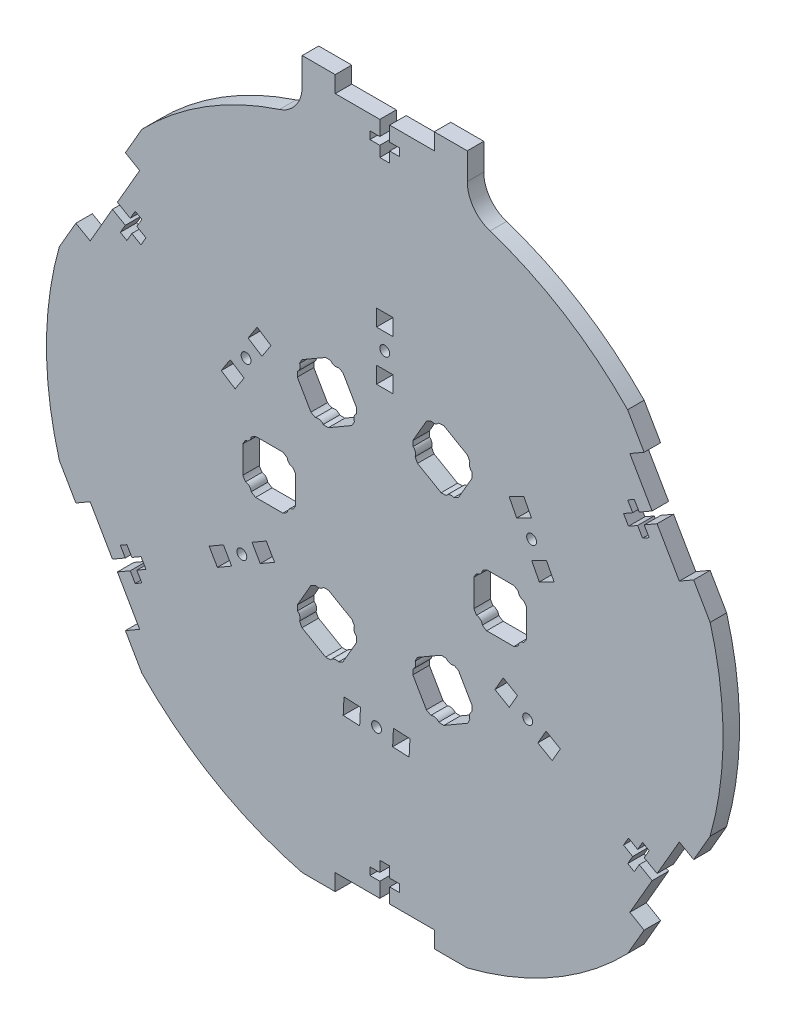
from build123d import *

# Parameters (mm, degrees)
ESQUISSE1_R        = 1.5
ESQUISSE1_W        = 5
ESQUISSE1_H        = 5
BOSS_EXTRU_1_DEPTH = 5
CONG_1_R           = 10


with BuildPart() as part:
    # Esquisse1 → Boss.-Extru.1 (new body)
    with BuildSketch(Plane.XY):
        with BuildLine():
            Line((-25, 99.40447676), (-25, 115))
            Line((-25, 115), (-15, 115))
            Line((-15, 115), (-15, 110))
            Line((-15, 110), (-1.5, 110))
            Line((-1.5, 110), (-1.5, 105.5))
            Line((-1.5, 105.5), (-4.5, 105.5))
            Line((-4.5, 105.5), (-4.5, 103.2))
            Line((-4.5, 103.2), (-1.5, 103.2))
            Line((-1.5, 103.2), (-1.5, 100))
            Line((-1.5, 100), (1.5, 100))
            Line((1.5, 100), (1.5, 103.2))
            Line((1.5, 103.2), (4.5, 103.2))
            Line((4.5, 103.2), (4.5, 105.5))
            Line((4.5, 105.5), (1.5, 105.5))
            Line((1.5, 105.5), (1.5, 110))
            Line((1.5, 110), (15, 110))
            Line((15, 110), (15, 115))
            Line((15, 115), (25, 115))
            Line((25, 115), (25, 99.40447676))
            ThreePointArc((25, 99.40447676), (51.25, 88.767603888), (73.586802124, 71.352873475))
            Line((73.586802124, 71.352873475), (78.586802124, 62.692619437))
            Line((78.586802124, 62.692619437), (74.256675105, 60.192619437))
            Line((74.256675105, 60.192619437), (81.006675105, 48.501276486))
            Line((81.006675105, 48.501276486), (77.109560788, 46.251276486))
            Line((77.109560788, 46.251276486), (75.609560788, 48.849352697))
            Line((75.609560788, 48.849352697), (73.61770236, 47.699352697))
            Line((73.61770236, 47.699352697), (75.11770236, 45.101276486))
            Line((75.11770236, 45.101276486), (72.346421068, 43.501276486))
            Line((72.346421068, 43.501276486), (73.846421068, 40.903200275))
            Line((73.846421068, 40.903200275), (76.61770236, 42.503200275))
            Line((76.61770236, 42.503200275), (78.11770236, 39.905124063))
            Line((78.11770236, 39.905124063), (80.109560788, 41.055124063))
            Line((80.109560788, 41.055124063), (78.609560788, 43.653200275))
            Line((78.609560788, 43.653200275), (82.506675105, 45.903200275))
            Line((82.506675105, 45.903200275), (89.256675105, 34.211857323))
            Line((89.256675105, 34.211857323), (93.586802124, 36.711857323))
            Line((93.586802124, 36.711857323), (98.586802124, 28.051603286))
            ThreePointArc((98.586802124, 28.051603286), (102.5, 0), (98.586802124, -28.051603286))
            Line((98.586802124, -28.051603286), (93.586802124, -36.711857323))
            Line((93.586802124, -36.711857323), (89.256675105, -34.211857323))
            Line((89.256675105, -34.211857323), (82.506675105, -45.903200275))
            Line((82.506675105, -45.903200275), (78.609560788, -43.653200275))
            Line((78.609560788, -43.653200275), (80.109560788, -41.055124063))
            Line((80.109560788, -41.055124063), (78.11770236, -39.905124063))
            Line((78.11770236, -39.905124063), (76.61770236, -42.503200275))
            Line((76.61770236, -42.503200275), (73.846421068, -40.903200275))
            Line((73.846421068, -40.903200275), (72.346421068, -43.501276486))
            Line((72.346421068, -43.501276486), (75.11770236, -45.101276486))
            Line((75.11770236, -45.101276486), (73.61770236, -47.699352697))
            Line((73.61770236, -47.699352697), (75.609560788, -48.849352697))
            Line((75.609560788, -48.849352697), (77.109560788, -46.251276486))
            Line((77.109560788, -46.251276486), (81.006675105, -48.501276486))
            Line((81.006675105, -48.501276486), (74.256675105, -60.192619437))
            Line((74.256675105, -60.192619437), (78.586802124, -62.692619437))
            Line((78.586802124, -62.692619437), (73.586802124, -71.352873475))
            ThreePointArc((73.586802124, -71.352873475), (51.25, -88.767603888), (25, -99.40447676))
            Line((25, -99.40447676), (15, -99.40447676))
            Line((15, -99.40447676), (15, -94.40447676))
            Line((15, -94.40447676), (1.5, -94.40447676))
            Line((1.5, -94.40447676), (1.5, -89.90447676))
            Line((1.5, -89.90447676), (4.5, -89.90447676))
            Line((4.5, -89.90447676), (4.5, -87.60447676))
            Line((4.5, -87.60447676), (1.5, -87.60447676))
            Line((1.5, -87.60447676), (1.5, -84.40447676))
            Line((1.5, -84.40447676), (-1.5, -84.40447676))
            Line((-1.5, -84.40447676), (-1.5, -87.60447676))
            Line((-1.5, -87.60447676), (-4.5, -87.60447676))
            Line((-4.5, -87.60447676), (-4.5, -89.90447676))
            Line((-4.5, -89.90447676), (-1.5, -89.90447676))
            Line((-1.5, -89.90447676), (-1.5, -94.40447676))
            Line((-1.5, -94.40447676), (-15, -94.40447676))
            Line((-15, -94.40447676), (-15, -99.40447676))
            Line((-15, -99.40447676), (-25, -99.40447676))
            ThreePointArc((-25, -99.40447676), (-51.25, -88.767603888), (-73.586802124, -71.352873475))
            Line((-73.586802124, -71.352873475), (-78.586802124, -62.692619437))
            Line((-78.586802124, -62.692619437), (-74.256675105, -60.192619437))
            Line((-74.256675105, -60.192619437), (-81.006675105, -48.501276486))
            Line((-81.006675105, -48.501276486), (-77.109560788, -46.251276486))
            Line((-77.109560788, -46.251276486), (-75.609560788, -48.849352697))
            Line((-75.609560788, -48.849352697), (-73.61770236, -47.699352697))
            Line((-73.61770236, -47.699352697), (-75.11770236, -45.101276486))
            Line((-75.11770236, -45.101276486), (-72.346421068, -43.501276486))
            Line((-72.346421068, -43.501276486), (-73.846421068, -40.903200275))
            Line((-73.846421068, -40.903200275), (-76.61770236, -42.503200275))
            Line((-76.61770236, -42.503200275), (-78.11770236, -39.905124063))
            Line((-78.11770236, -39.905124063), (-80.109560788, -41.055124063))
            Line((-80.109560788, -41.055124063), (-78.609560788, -43.653200275))
            Line((-78.609560788, -43.653200275), (-82.506675105, -45.903200275))
            Line((-82.506675105, -45.903200275), (-89.256675105, -34.211857323))
            Line((-89.256675105, -34.211857323), (-93.586802124, -36.711857323))
            Line((-93.586802124, -36.711857323), (-98.586802124, -28.051603286))
            ThreePointArc((-98.586802124, -28.051603286), (-102.5, 0), (-98.586802124, 28.051603286))
            Line((-98.586802124, 28.051603286), (-93.586802124, 36.711857323))
            Line((-93.586802124, 36.711857323), (-89.256675105, 34.211857323))
            Line((-89.256675105, 34.211857323), (-82.506675105, 45.903200275))
            Line((-82.506675105, 45.903200275), (-78.609560788, 43.653200275))
            Line((-78.609560788, 43.653200275), (-80.109560788, 41.055124063))
            Line((-80.109560788, 41.055124063), (-78.11770236, 39.905124063))
            Line((-78.11770236, 39.905124063), (-76.61770236, 42.503200275))
            Line((-76.61770236, 42.503200275), (-73.846421068, 40.903200275))
            Line((-73.846421068, 40.903200275), (-72.346421068, 43.501276486))
            Line((-72.346421068, 43.501276486), (-75.11770236, 45.101276486))
            Line((-75.11770236, 45.101276486), (-73.61770236, 47.699352697))
            Line((-73.61770236, 47.699352697), (-75.609560788, 48.849352697))
            Line((-75.609560788, 48.849352697), (-77.109560788, 46.251276486))
            Line((-77.109560788, 46.251276486), (-81.006675105, 48.501276486))
            Line((-81.006675105, 48.501276486), (-74.256675105, 60.192619437))
            Line((-74.256675105, 60.192619437), (-78.586802124, 62.692619437))
            Line((-78.586802124, 62.692619437), (-73.586802124, 71.352873475))
            ThreePointArc((-73.586802124, 71.352873475), (-51.25, 88.767603888), (-25, 99.40447676))
        make_face()
        with Locations((0, 50)):
            Circle(ESQUISSE1_R, mode=Mode.SUBTRACT)
        with Locations((43.301270189, -25)):
            Circle(ESQUISSE1_R, mode=Mode.SUBTRACT)
        with Locations((-43.301270189, -25)):
            Circle(ESQUISSE1_R, mode=Mode.SUBTRACT)
        with Locations((44.488956137, 22.819570151)):
            Circle(ESQUISSE1_R, mode=Mode.SUBTRACT)
        with Locations((-2.482150614, -49.938351278)):
            Circle(ESQUISSE1_R, mode=Mode.SUBTRACT)
        with Locations((-42.006805523, 27.118781127)):
            Circle(ESQUISSE1_R, mode=Mode.SUBTRACT)
        with Locations((0, 42.5)):
            Rectangle(ESQUISSE1_W, ESQUISSE1_H, mode=Mode.SUBTRACT)
        with Locations((0, 57.5)):
            Rectangle(ESQUISSE1_W, ESQUISSE1_H, mode=Mode.SUBTRACT)
        Polygon((40.22114317, -20.334936491), (35.891016151, -17.834936491), (33.391016151, -22.165063509), (37.72114317, -24.665063509), align=None, mode=Mode.SUBTRACT)
        Polygon((48.881397208, -25.334936491), (53.211524227, -27.834936491), (50.711524227, -32.165063509), (46.381397208, -29.665063509), align=None, mode=Mode.SUBTRACT)
        Polygon((-37.72114317, -24.665063509), (-33.391016151, -22.165063509), (-35.891016151, -17.834936491), (-40.22114317, -20.334936491), align=None, mode=Mode.SUBTRACT)
        Polygon((-46.381397208, -29.665063509), (-50.711524227, -32.165063509), (-53.211524227, -27.834936491), (-48.881397208, -25.334936491), align=None, mode=Mode.SUBTRACT)
        Polygon((44.431446928, 28.409444272), (42.149489913, 32.858339886), (37.7005943, 30.576382871), (39.982551315, 26.127487257), align=None, mode=Mode.SUBTRACT)
        Polygon((48.995360959, 19.511653045), (51.277317974, 15.062757431), (46.82842236, 12.780800416), (44.546465345, 17.22969603), align=None, mode=Mode.SUBTRACT)
        Polygon((2.387576983, -52.683483903), (7.381412111, -52.931698964), (7.629627172, -47.937863837), (2.635792044, -47.689648775), align=None, mode=Mode.SUBTRACT)
        Polygon((-7.600093273, -52.18705378), (-12.5939284, -51.938838719), (-12.345713339, -46.945003591), (-7.351878211, -47.193218652), align=None, mode=Mode.SUBTRACT)
        Polygon((-46.819023911, 24.274039631), (-49.530902024, 20.073359078), (-45.330221472, 17.361480966), (-42.618343359, 21.562161518), align=None, mode=Mode.SUBTRACT)
        Polygon((-41.395267686, 32.675400735), (-38.683389573, 36.876081287), (-34.482709021, 34.164203175), (-37.194587134, 29.963522623), align=None, mode=Mode.SUBTRACT)
        with BuildLine():
            Line((-17.929285786, 39.300645176), (-25.070714214, 35.17753955))
            ThreePointArc((-25.070714214, 35.17753955), (-25.463537004, 34.503988033), (-25.796585938, 33.798963354))
            ThreePointArc((-25.796585938, 33.798963354), (-25.710369523, 32.510851016), (-26.429091298, 31.438421215))
            ThreePointArc((-26.429091298, 31.438421215), (-26.4931748, 30.661327466), (-26.489756043, 29.881603347))
            Line((-26.489756043, 29.881603347), (-22.366650417, 22.740174918))
            ThreePointArc((-22.366650417, 22.740174918), (-21.693098901, 22.347352129), (-20.988074222, 22.014303195))
            ThreePointArc((-20.988074222, 22.014303195), (-19.699961883, 22.100519609), (-18.627532082, 21.381797835))
            ThreePointArc((-18.627532082, 21.381797835), (-17.850438333, 21.317714333), (-17.070714214, 21.321133089))
            Line((-17.070714214, 21.321133089), (-9.929285786, 25.444238715))
            ThreePointArc((-9.929285786, 25.444238715), (-9.536462996, 26.117790232), (-9.203414062, 26.822814911))
            ThreePointArc((-9.203414062, 26.822814911), (-9.289630477, 28.110927249), (-8.570908702, 29.18335705))
            ThreePointArc((-8.570908702, 29.18335705), (-8.5068252, 29.960450799), (-8.510243957, 30.740174918))
            Line((-8.510243957, 30.740174918), (-12.633349583, 37.881603347))
            ThreePointArc((-12.633349583, 37.881603347), (-13.306901099, 38.274426136), (-14.011925778, 38.60747507))
            ThreePointArc((-14.011925778, 38.60747507), (-15.300038117, 38.521258656), (-16.372467918, 39.23998043))
            ThreePointArc((-16.372467918, 39.23998043), (-17.149561667, 39.304063932), (-17.929285786, 39.300645176))
        make_face(mode=Mode.SUBTRACT)
        with BuildLine():
            Line((25.070714214, 35.17753955), (17.929285786, 39.300645176))
            ThreePointArc((17.929285786, 39.300645176), (17.149561667, 39.304063932), (16.372467918, 39.23998043))
            ThreePointArc((16.372467918, 39.23998043), (15.300038117, 38.521258656), (14.011925778, 38.60747507))
            ThreePointArc((14.011925778, 38.60747507), (13.306901099, 38.274426136), (12.633349583, 37.881603347))
            Line((12.633349583, 37.881603347), (8.510243957, 30.740174918))
            ThreePointArc((8.510243957, 30.740174918), (8.5068252, 29.960450799), (8.570908702, 29.18335705))
            ThreePointArc((8.570908702, 29.18335705), (9.289630477, 28.110927249), (9.203414062, 26.822814911))
            ThreePointArc((9.203414062, 26.822814911), (9.536462996, 26.117790232), (9.929285786, 25.444238715))
            Line((9.929285786, 25.444238715), (17.070714214, 21.321133089))
            ThreePointArc((17.070714214, 21.321133089), (17.850438333, 21.317714333), (18.627532082, 21.381797835))
            ThreePointArc((18.627532082, 21.381797835), (19.699961883, 22.100519609), (20.988074222, 22.014303195))
            ThreePointArc((20.988074222, 22.014303195), (21.693098901, 22.347352129), (22.366650417, 22.740174918))
            Line((22.366650417, 22.740174918), (26.489756043, 29.881603347))
            ThreePointArc((26.489756043, 29.881603347), (26.4931748, 30.661327466), (26.429091298, 31.438421215))
            ThreePointArc((26.429091298, 31.438421215), (25.710369523, 32.510851016), (25.796585938, 33.798963354))
            ThreePointArc((25.796585938, 33.798963354), (25.463537004, 34.503988033), (25.070714214, 35.17753955))
        make_face(mode=Mode.SUBTRACT)
        with BuildLine():
            Line((43, -4.123105626), (43, 4.123105626))
            ThreePointArc((43, 4.123105626), (42.61309867, 4.800075899), (42.169053855, 5.441017076))
            ThreePointArc((42.169053855, 5.441017076), (41.01040764, 6.01040764), (40.441017076, 7.169053855))
            ThreePointArc((40.441017076, 7.169053855), (39.800075899, 7.61309867), (39.123105626, 8))
            Line((39.123105626, 8), (30.876894374, 8))
            ThreePointArc((30.876894374, 8), (30.199924101, 7.61309867), (29.558982924, 7.169053855))
            ThreePointArc((29.558982924, 7.169053855), (28.98959236, 6.01040764), (27.830946145, 5.441017076))
            ThreePointArc((27.830946145, 5.441017076), (27.38690133, 4.800075899), (27, 4.123105626))
            Line((27, 4.123105626), (27, -4.123105626))
            ThreePointArc((27, -4.123105626), (27.38690133, -4.800075899), (27.830946145, -5.441017076))
            ThreePointArc((27.830946145, -5.441017076), (28.98959236, -6.01040764), (29.558982924, -7.169053855))
            ThreePointArc((29.558982924, -7.169053855), (30.199924101, -7.61309867), (30.876894374, -8))
            Line((30.876894374, -8), (39.123105626, -8))
            ThreePointArc((39.123105626, -8), (39.800075899, -7.61309867), (40.441017076, -7.169053855))
            ThreePointArc((40.441017076, -7.169053855), (41.01040764, -6.01040764), (42.169053855, -5.441017076))
            ThreePointArc((42.169053855, -5.441017076), (42.61309867, -4.800075899), (43, -4.123105626))
        make_face(mode=Mode.SUBTRACT)
        with BuildLine():
            Line((17.929285786, -39.300645176), (25.070714214, -35.17753955))
            ThreePointArc((25.070714214, -35.17753955), (25.463537004, -34.503988033), (25.796585938, -33.798963354))
            ThreePointArc((25.796585938, -33.798963354), (25.710369523, -32.510851016), (26.429091298, -31.438421215))
            ThreePointArc((26.429091298, -31.438421215), (26.4931748, -30.661327466), (26.489756043, -29.881603347))
            Line((26.489756043, -29.881603347), (22.366650417, -22.740174918))
            ThreePointArc((22.366650417, -22.740174918), (21.693098901, -22.347352129), (20.988074222, -22.014303195))
            ThreePointArc((20.988074222, -22.014303195), (19.699961883, -22.100519609), (18.627532082, -21.381797835))
            ThreePointArc((18.627532082, -21.381797835), (17.850438333, -21.317714333), (17.070714214, -21.321133089))
            Line((17.070714214, -21.321133089), (9.929285786, -25.444238715))
            ThreePointArc((9.929285786, -25.444238715), (9.536462996, -26.117790232), (9.203414062, -26.822814911))
            ThreePointArc((9.203414062, -26.822814911), (9.289630477, -28.110927249), (8.570908702, -29.18335705))
            ThreePointArc((8.570908702, -29.18335705), (8.5068252, -29.960450799), (8.510243957, -30.740174918))
            Line((8.510243957, -30.740174918), (12.633349583, -37.881603347))
            ThreePointArc((12.633349583, -37.881603347), (13.306901099, -38.274426136), (14.011925778, -38.60747507))
            ThreePointArc((14.011925778, -38.60747507), (15.300038117, -38.521258656), (16.372467918, -39.23998043))
            ThreePointArc((16.372467918, -39.23998043), (17.149561667, -39.304063932), (17.929285786, -39.300645176))
        make_face(mode=Mode.SUBTRACT)
        with BuildLine():
            Line((-25.070714214, -35.17753955), (-17.929285786, -39.300645176))
            ThreePointArc((-17.929285786, -39.300645176), (-17.149561667, -39.304063932), (-16.372467918, -39.23998043))
            ThreePointArc((-16.372467918, -39.23998043), (-15.300038117, -38.521258656), (-14.011925778, -38.60747507))
            ThreePointArc((-14.011925778, -38.60747507), (-13.306901099, -38.274426136), (-12.633349583, -37.881603347))
            Line((-12.633349583, -37.881603347), (-8.510243957, -30.740174918))
            ThreePointArc((-8.510243957, -30.740174918), (-8.5068252, -29.960450799), (-8.570908702, -29.18335705))
            ThreePointArc((-8.570908702, -29.18335705), (-9.289630477, -28.110927249), (-9.203414062, -26.822814911))
            ThreePointArc((-9.203414062, -26.822814911), (-9.536462996, -26.117790232), (-9.929285786, -25.444238715))
            Line((-9.929285786, -25.444238715), (-17.070714214, -21.321133089))
            ThreePointArc((-17.070714214, -21.321133089), (-17.850438333, -21.317714333), (-18.627532082, -21.381797835))
            ThreePointArc((-18.627532082, -21.381797835), (-19.699961883, -22.100519609), (-20.988074222, -22.014303195))
            ThreePointArc((-20.988074222, -22.014303195), (-21.693098901, -22.347352129), (-22.366650417, -22.740174918))
            Line((-22.366650417, -22.740174918), (-26.489756043, -29.881603347))
            ThreePointArc((-26.489756043, -29.881603347), (-26.4931748, -30.661327466), (-26.429091298, -31.438421215))
            ThreePointArc((-26.429091298, -31.438421215), (-25.710369523, -32.510851016), (-25.796585938, -33.798963354))
            ThreePointArc((-25.796585938, -33.798963354), (-25.463537004, -34.503988033), (-25.070714214, -35.17753955))
        make_face(mode=Mode.SUBTRACT)
        with BuildLine():
            Line((-43, 4.123105626), (-43, -4.123105626))
            ThreePointArc((-43, -4.123105626), (-42.61309867, -4.800075899), (-42.169053855, -5.441017076))
            ThreePointArc((-42.169053855, -5.441017076), (-41.01040764, -6.01040764), (-40.441017076, -7.169053855))
            ThreePointArc((-40.441017076, -7.169053855), (-39.800075899, -7.61309867), (-39.123105626, -8))
            Line((-39.123105626, -8), (-30.876894374, -8))
            ThreePointArc((-30.876894374, -8), (-30.199924101, -7.61309867), (-29.558982924, -7.169053855))
            ThreePointArc((-29.558982924, -7.169053855), (-28.98959236, -6.01040764), (-27.830946145, -5.441017076))
            ThreePointArc((-27.830946145, -5.441017076), (-27.38690133, -4.800075899), (-27, -4.123105626))
            Line((-27, -4.123105626), (-27, 4.123105626))
            ThreePointArc((-27, 4.123105626), (-27.38690133, 4.800075899), (-27.830946145, 5.441017076))
            ThreePointArc((-27.830946145, 5.441017076), (-28.98959236, 6.01040764), (-29.558982924, 7.169053855))
            ThreePointArc((-29.558982924, 7.169053855), (-30.199924101, 7.61309867), (-30.876894374, 8))
            Line((-30.876894374, 8), (-39.123105626, 8))
            ThreePointArc((-39.123105626, 8), (-39.800075899, 7.61309867), (-40.441017076, 7.169053855))
            ThreePointArc((-40.441017076, 7.169053855), (-41.01040764, 6.01040764), (-42.169053855, 5.441017076))
            ThreePointArc((-42.169053855, 5.441017076), (-42.61309867, 4.800075899), (-43, 4.123105626))
        make_face(mode=Mode.SUBTRACT)
    extrude(amount=BOSS_EXTRU_1_DEPTH)

    # Congé1
    cong_1_edges = [part.edges().sort_by_distance(p)[0] for p in [
        (25, 99.40447676, 2.5),
        (-25, 99.40447676, 2.5),
    ]]
    fillet(cong_1_edges, radius=CONG_1_R)


solid = part.part
